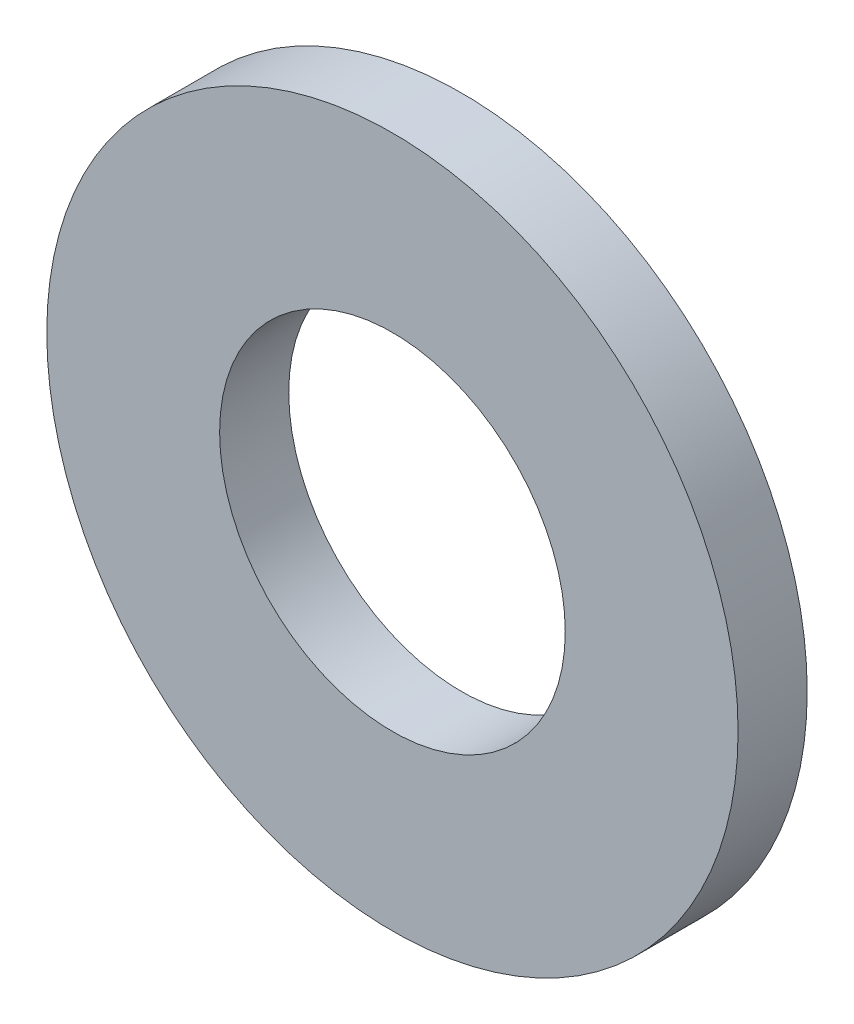
from build123d import *

# Parameters (mm, degrees)
ESQUISSE1_R             = 6
BOSS_EXTRU_1_DEPTH      = 1.2
ESQUISSE2_R             = 3
ENL_V_MAT_EXTRU_1_DEPTH = 1.2


with BuildPart() as part:
    # Esquisse1 → Boss.-Extru.1 (new body)
    with BuildSketch(Plane.XY):
        Circle(ESQUISSE1_R)
    extrude(amount=BOSS_EXTRU_1_DEPTH)

    # Esquisse2 → Enlèv. mat.-Extru.1 (cut)
    with BuildSketch(Plane.XY.offset(1.2)):
        Circle(ESQUISSE2_R)
    extrude(amount=-ENL_V_MAT_EXTRU_1_DEPTH, mode=Mode.SUBTRACT)


solid = part.part
